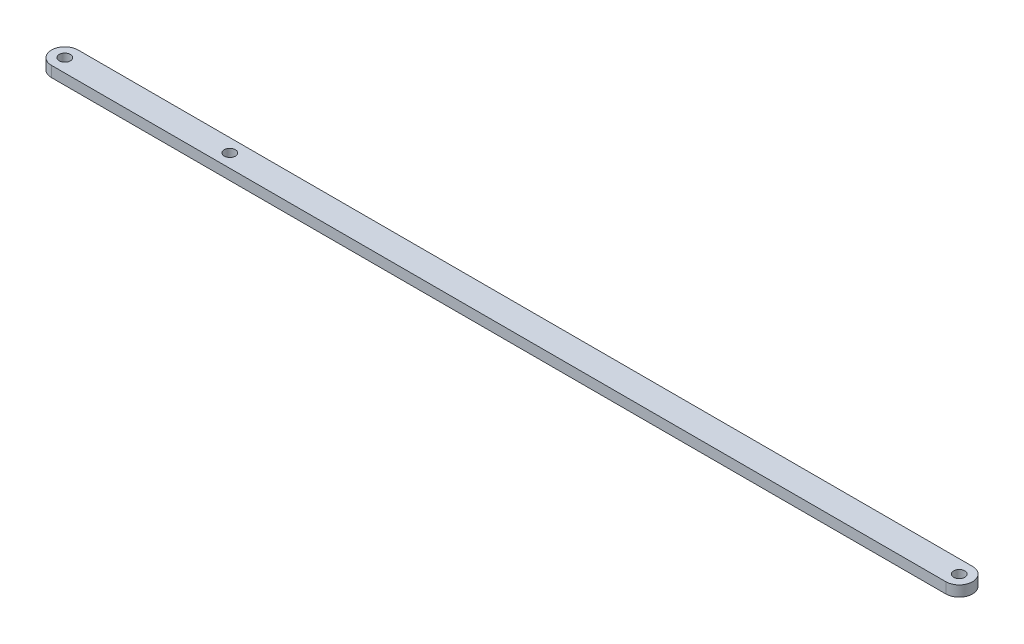
from build123d import *

# Parameters (mm, degrees)
SKETCH1_R           = 1.05
BOSS_EXTRUDE1_DEPTH = 2


with BuildPart() as part:
    # Sketch1 → Boss-Extrude1 (new body)
    with BuildSketch(Plane(origin=(0, 0, 0), x_dir=(1, 0, 0), z_dir=(0, 1, 0))):
        with BuildLine():
            Line((0, 2.5), (168, 2.5))
            ThreePointArc((168, 2.5), (170.5, 0), (168, -2.5))
            Line((168, -2.5), (0, -2.5))
            ThreePointArc((0, -2.5), (-2.5, 0), (0, 2.5))
        make_face()
        with Locations(Location((0, 0, 0), (0, 0, 270))):
            Circle(SKETCH1_R, mode=Mode.SUBTRACT)
        with Locations(Location((168, 0, 0), (0, 0, 270))):
            Circle(SKETCH1_R, mode=Mode.SUBTRACT)
        with Locations(Location((31, 0, 0), (0, 0, 270))):
            Circle(SKETCH1_R, mode=Mode.SUBTRACT)
    extrude(amount=BOSS_EXTRUDE1_DEPTH)


solid = part.part
